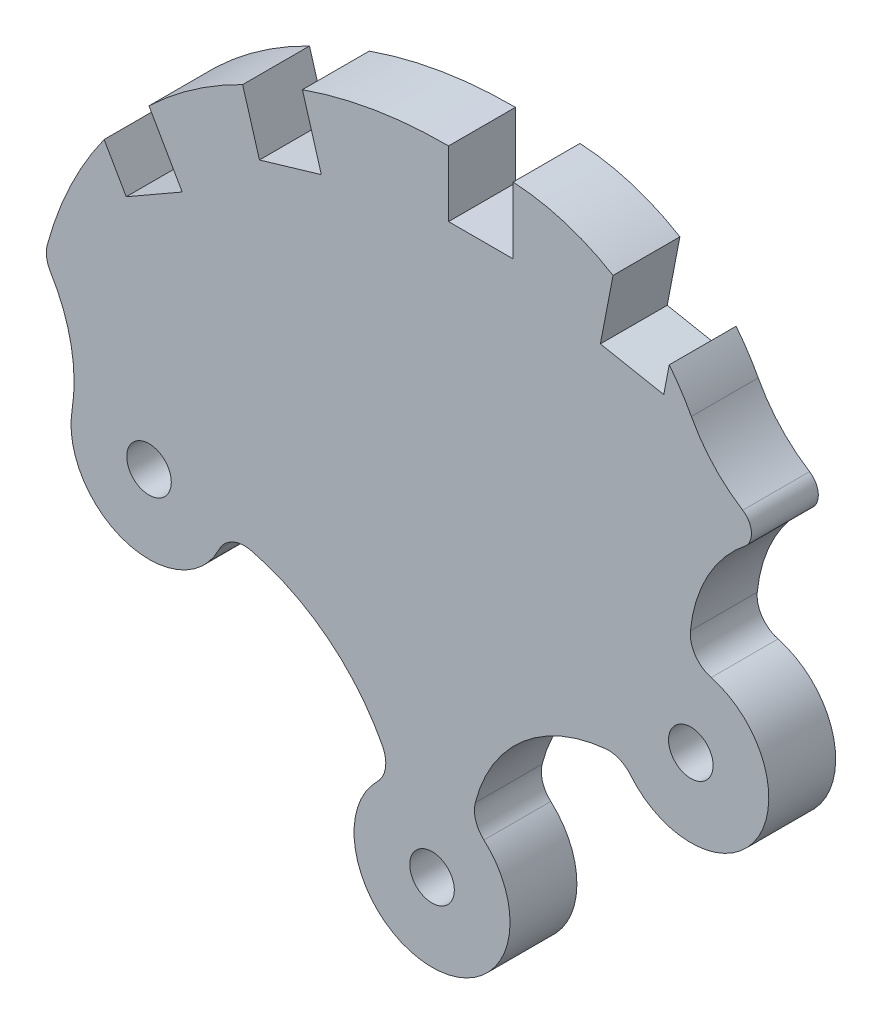
from build123d import *

# Parameters (mm, degrees)
SKETCH_1_R          = 1
EXTRUDE_1_DEPTH     = 3
FILLET_2_R          = 0.508
FILLET_3_R          = 1.27
SKETCH_3_W          = 2.895
SKETCH_3_H          = 3
CUT_EXTRUDE_1_DEPTH = 3


with BuildPart() as part:
    # 스케치1 → 보스-돌출1 (new body)
    with BuildSketch(Plane.XY):
        with BuildLine():
            ThreePointArc((-17.404694621, 2.689152768), (-14.003146094, 9.533383958), (-7.898975086, 14.132637079))
            ThreePointArc((-7.898975086, 14.132637079), (-3.181334345, 15.718511975), (1.784123639, 16.058159386))
            ThreePointArc((1.784123639, 16.058159386), (7.503730287, 15.09544823), (11.636286652, 11.025719632))
            ThreePointArc((11.636286652, 11.025719632), (12.626023912, 9.630255586), (13.939804575, 8.534408829))
            ThreePointArc((13.939804575, 8.534408829), (14.323714016, 7.94412001), (14.129144933, 7.267385039))
            ThreePointArc((14.129144933, 7.267385039), (12.117054941, 4.680354007), (11.583823092, 1.44664105))
            ThreePointArc((11.583823092, 1.44664105), (14.643044666, -3.801243579), (8.56860409, -3.783882772))
            ThreePointArc((8.56860409, -3.783882772), (4.032207962, -5.42180917), (1.784123639, -9.688870172))
            ThreePointArc((1.784123639, -9.688870172), (0, -16.2), (-1.784123639, -9.688870172))
            ThreePointArc((-1.784123639, -9.688870172), (-4.704806794, -5.722399103), (-9.262378909, -3.853758086))
            ThreePointArc((-9.262378909, -3.853758086), (-13.309581542, -6.642419158), (-16.154715264, -2.634714849))
            ThreePointArc((-16.154715264, -2.634714849), (-16.251667385, 0.151195755), (-17.404694621, 2.689152768))
        make_face()
        with Locations((-12.7, -3.195912181)):
            Circle(SKETCH_1_R, mode=Mode.SUBTRACT)
        with Locations((0, -12.7)):
            Circle(SKETCH_1_R, mode=Mode.SUBTRACT)
        with Locations((11.610795337, -2.05325502)):
            Circle(SKETCH_1_R, mode=Mode.SUBTRACT)
    extrude(amount=EXTRUDE_1_DEPTH)

    # 필렛2
    fillet_2_edges = [part.edges().sort_by_distance(p)[0] for p in [
        (14.129144933, 7.267385039, 1.5),
    ]]
    fillet(fillet_2_edges, radius=FILLET_2_R)

    # 필렛3
    fillet_3_edges = [part.edges().sort_by_distance(p)[0] for p in [
        (1.784123639, -9.688870172, 1.5),
        (-1.784123639, -9.688870172, 1.5),
        (-9.262378909, -3.853758086, 1.5),
        (-17.404694621, 2.689152768, 1.5),
        (11.583823092, 1.44664105, 1.5),
        (8.56860409, -3.783882772, 1.5),
    ]]
    fillet(fillet_3_edges, radius=FILLET_3_R)

    # 스케치3 → 컷-돌출1 (cut)
    with BuildSketch(Plane.XY.offset(3)):
        Polygon((-13.722156846, 6.885379209), (-11.210602391, 8.325212263), (-12.702657369, 10.927859366), (-15.214211823, 9.488026313), align=None)
        Polygon((-7.745048824, 11.302508101), (-4.968377523, 12.121728149), (-5.817310215, 14.999107735), (-8.593981516, 14.179887687), align=None)
        with Locations((2.188643344, 14.650807918)):
            Rectangle(SKETCH_3_W, SKETCH_3_H)
        Polygon((7.553748194, 11.804988601), (10.396441684, 11.257157677), (10.964142123, 14.20295404), (8.121448633, 14.750784964), align=None)
    extrude(amount=-CUT_EXTRUDE_1_DEPTH, mode=Mode.SUBTRACT)


solid = part.part
